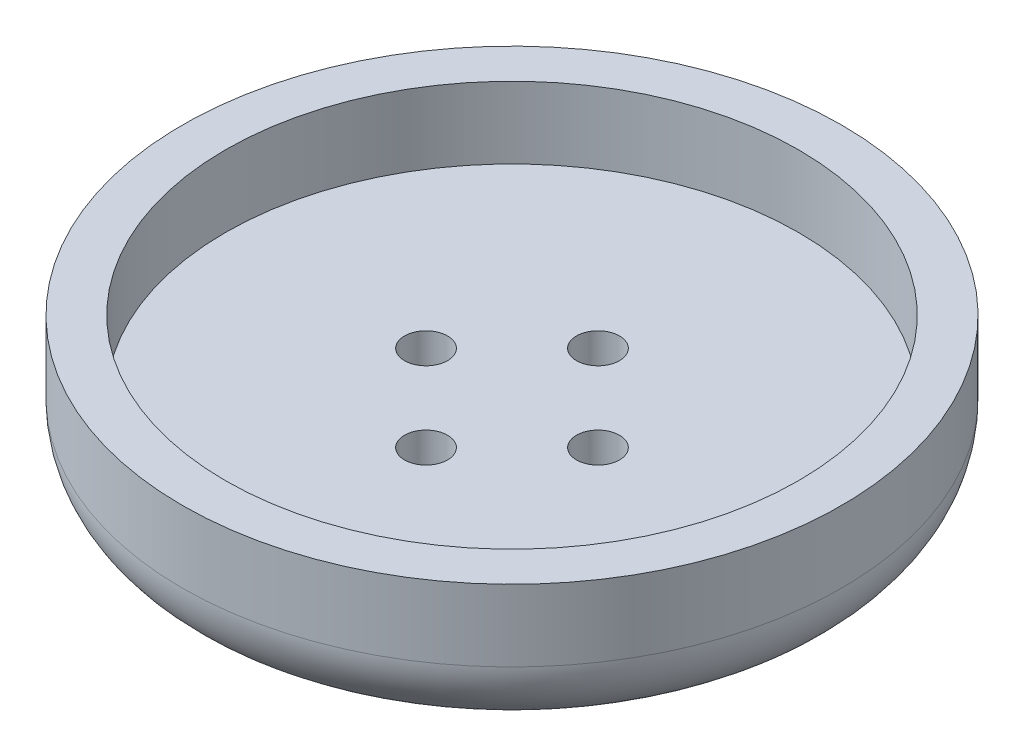
from build123d import *

# Parameters (mm, degrees)
SKETCH6_R           = 23
BOSS_EXTRUDE3_DEPTH = 25
SKETCH7_R           = 1.5
CUT_EXTRUDE2_DEPTH  = 5
SKETCH8_R           = 1.25
CUT_EXTRUDE3_DEPTH  = 5
SKETCH9_R           = 4
BOSS_EXTRUDE4_DEPTH = 2
SKETCH10_R          = 2
BOSS_EXTRUDE5_DEPTH = 3
FILLET1_R           = 5
FILLET2_R           = 2
SKETCH11_W          = 58.747444177
SKETCH11_H          = 21.595633685
CUT_EXTRUDE4_DEPTH  = 50
SKETCH12_R          = 20
CUT_EXTRUDE5_DEPTH  = 5


with BuildPart() as part:
    # Sketch6 → Boss-Extrude3 (new body)
    with BuildSketch(Plane(origin=(0, 0, 0), x_dir=(1, 0, 0), z_dir=(0, 1, 0))):
        with Locations(Location((0, 0, 0), (0, 0, 270))):
            Circle(SKETCH6_R)
    extrude(amount=BOSS_EXTRUDE3_DEPTH)

    # Sketch7 → Cut-Extrude2 (cut)
    with BuildSketch(Plane(origin=(0, 0, 0), x_dir=(1, 0, 0), z_dir=(0, 1, 0))):
        with Locations(Location((-6, 0, 0), (0, 0, 270))):
            Circle(SKETCH7_R)
        with Locations(Location((0, 6, 0), (0, 0, 270))):
            Circle(SKETCH7_R)
        with Locations(Location((6, 0, 0), (0, 0, 270))):
            Circle(SKETCH7_R)
        with Locations(Location((0, -6, 0), (0, 0, 270))):
            Circle(SKETCH7_R)
    extrude(amount=CUT_EXTRUDE2_DEPTH, mode=Mode.SUBTRACT)

    # Sketch8 → Cut-Extrude3 (cut)
    with BuildSketch(Plane(origin=(0, 25, 0), x_dir=(1, 0, 0), z_dir=(0, 1, 0))):
        with Locations(Location((-13.856406461, -8, 0), (0, 0, 270))):
            Circle(SKETCH8_R)
        with Locations(Location((0, 16, 0), (0, 0, 270))):
            Circle(SKETCH8_R)
        with Locations(Location((13.856406461, -8, 0), (0, 0, 270))):
            Circle(SKETCH8_R)
    extrude(amount=-CUT_EXTRUDE3_DEPTH, mode=Mode.SUBTRACT)

    # Sketch9 → Boss-Extrude4 (add)
    with BuildSketch(Plane(origin=(0, 25, 0), x_dir=(1, 0, 0), z_dir=(0, 1, 0))):
        with Locations(Location((0, 0, 0), (0, 0, 270))):
            Circle(SKETCH9_R)
    extrude(amount=BOSS_EXTRUDE4_DEPTH)

    # Sketch10 → Boss-Extrude5 (add)
    with BuildSketch(Plane.XZ):
        with Locations(Location((0, 0, 0), (0, 0, 90))):
            Circle(SKETCH10_R)
    extrude(amount=BOSS_EXTRUDE5_DEPTH)

    # Fillet1
    fillet1_edges = [part.edges().sort_by_distance(p)[0] for p in [
        (0, 0, -23),
    ]]
    fillet(fillet1_edges, radius=FILLET1_R)

    # Fillet2
    fillet2_edges = [part.edges().sort_by_distance(p)[0] for p in [
        (0, 25, -23),
    ]]
    fillet(fillet2_edges, radius=FILLET2_R)

    # Sketch11 → Cut-Extrude4 (cut, symmetric)
    with BuildSketch(Plane(origin=(0, 0, 0), x_dir=(0, 0, -1), z_dir=(1, 0, 0))):
        with Locations((0.983000007, 20.797816843)):
            Rectangle(SKETCH11_W, SKETCH11_H)
    extrude(amount=CUT_EXTRUDE4_DEPTH, both=True, mode=Mode.SUBTRACT)

    # Sketch12 → Cut-Extrude5 (cut)
    with BuildSketch(Plane(origin=(0, 10, 0), x_dir=(1, 0, 0), z_dir=(0, 1, 0))):
        with Locations(Location((0, 0, 0), (0, 0, 270))):
            Circle(SKETCH12_R)
    extrude(amount=-CUT_EXTRUDE5_DEPTH, mode=Mode.SUBTRACT)


solid = part.part
